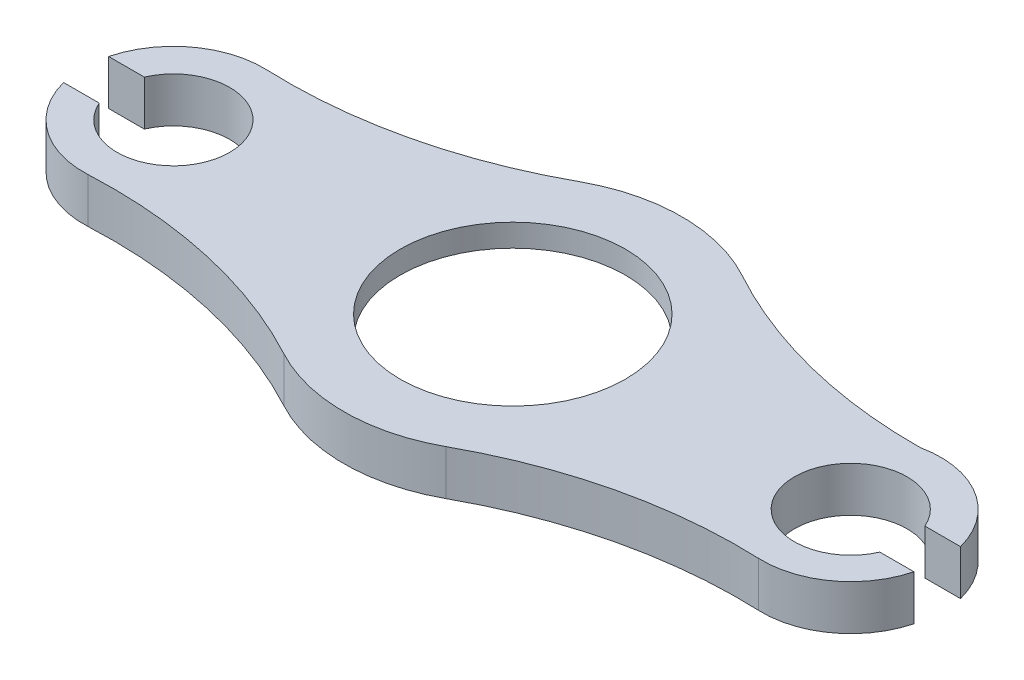
from build123d import *

# Parameters (mm, degrees)
SKETCH1_R           = 50
BOSS_EXTRUDE1_DEPTH = 20
SKETCH2_R           = 67.8
SKETCH2_R_2         = 50
CUT_EXTRUDE2_DEPTH  = 10


with BuildPart() as part:
    # Sketch1 → Boss-Extrude1 (new body)
    with BuildSketch(Plane(origin=(0, 0, 0), x_dir=(1, 0, 0), z_dir=(0, 1, 0))):
        with BuildLine():
            Line((172.912878475, 10), (188.729833462, 10))
            ThreePointArc((188.729833462, 10), (171.097880047, 33.983517439), (141.78172432, 39.146646662))
            ThreePointArc((141.78172432, 39.146646662), (87.249696592, 45.62224876), (36.143045028, 65.716666806))
            ThreePointArc((36.143045028, 65.716666806), (0, 75), (-36.143045028, 65.716666806))
            ThreePointArc((-36.143045028, 65.716666806), (-90.451837404, 44.84292871), (-148.370630479, 39.313798563))
            ThreePointArc((-148.370630479, 39.313798563), (-173.844765312, 31.461724235), (-188.728411831, 9.346939972))
            Line((-188.728411831, 9.346939972), (-172.911456843, 9.346939972))
            ThreePointArc((-172.911456843, 9.346939972), (-124.998578369, -0.653060028), (-172.911456843, -10.653060028))
            Line((-172.911456843, -10.653060028), (-188.728411831, -10.653060028))
            ThreePointArc((-188.728411831, -10.653060028), (-173.704720096, -32.871359866), (-148.022685389, -40.604228308))
            ThreePointArc((-148.022685389, -40.604228308), (-90.057943753, -45.628827643), (-35.569454559, -66.028886878))
            ThreePointArc((-35.569454559, -66.028886878), (0.322743626, -74.999305574), (36.136409347, -65.720315881))
            ThreePointArc((36.136409347, -65.720315881), (90.458572132, -44.849413277), (148.389781211, -39.3297249))
            ThreePointArc((148.389781211, -39.3297249), (173.396792242, -31.654544351), (188.071249852, -10))
            Line((188.071249852, -10), (172.912878475, -10))
            ThreePointArc((172.912878475, -10), (125, 0), (172.912878475, 10))
        make_face()
        with Locations(Location((0, 0, 0), (0, 0, 270))):
            Circle(SKETCH1_R, mode=Mode.SUBTRACT)
    extrude(amount=BOSS_EXTRUDE1_DEPTH)

    # Sketch2 → Cut-Extrude2 (cut)
    with BuildSketch(Plane(origin=(0, 0, 0), x_dir=(1, 0, 0), z_dir=(0, 1, 0))):
        with Locations(Location((0, 0, 0), (0, 0, 270))):
            Circle(SKETCH2_R)
        with Locations(Location((0, 0, 0), (0, 0, 270))):
            Circle(SKETCH2_R_2, mode=Mode.SUBTRACT)
    extrude(amount=CUT_EXTRUDE2_DEPTH, mode=Mode.SUBTRACT)


solid = part.part
